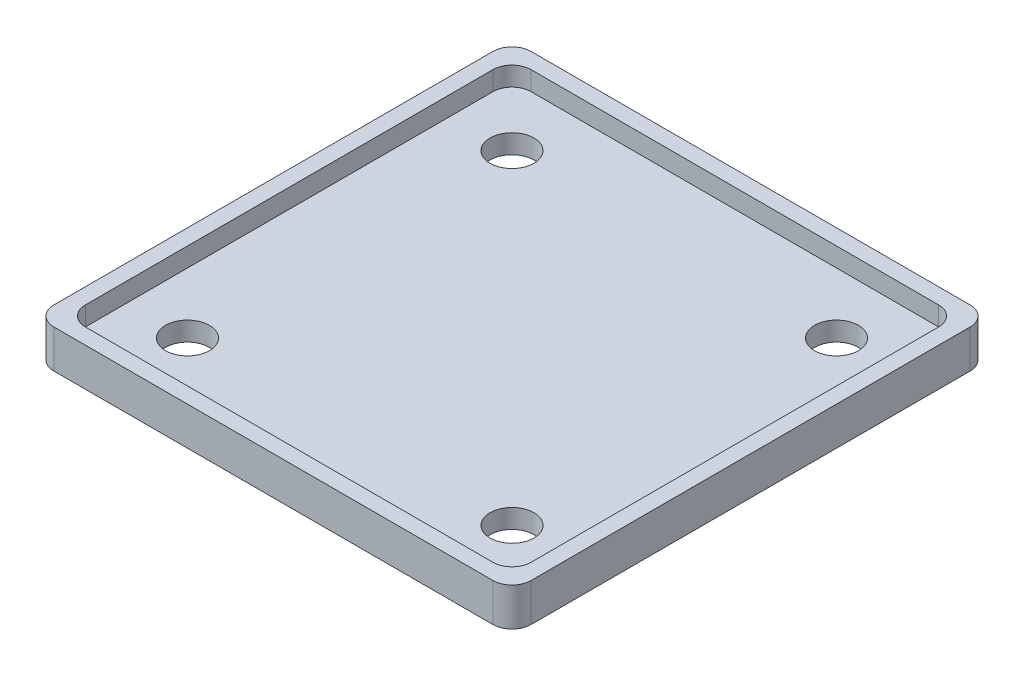
from build123d import *

# Parameters (mm, degrees)
SKETCH1_W           = 25
SKETCH1_H           = 25
BOSS_EXTRUDE1_DEPTH = 2
SKETCH2_R           = 1.15
CUT_EXTRUDE1_DEPTH  = 2
CUT_EXTRUDE2_DEPTH  = 1
FILLET1_R           = 1


with BuildPart() as part:
    # Sketch1 → Boss-Extrude1 (new body)
    with BuildSketch(Plane(origin=(0, 0, 0), x_dir=(1, 0, 0), z_dir=(0, 1, 0))):
        Rectangle(SKETCH1_W, SKETCH1_H)
    extrude(amount=BOSS_EXTRUDE1_DEPTH)

    # Sketch2 → Cut-Extrude1 (cut)
    with BuildSketch(Plane(origin=(0, 2, 0), x_dir=(1, 0, 0), z_dir=(0, 1, 0))):
        with Locations(Location((-8.5, 8.5, 0), (0, 0, 270))):
            Circle(SKETCH2_R)
        with Locations(Location((-8.5, -8.5, 0), (0, 0, 90))):
            Circle(SKETCH2_R)
        with Locations(Location((8.5, -8.5, 0), (0, 0, 270))):
            Circle(SKETCH2_R)
        with Locations(Location((8.5, 8.5, 0), (0, 0, 90))):
            Circle(SKETCH2_R)
    extrude(amount=-CUT_EXTRUDE1_DEPTH, mode=Mode.SUBTRACT)

    # Sketch3 → Cut-Extrude2 (cut)
    with BuildSketch(Plane(origin=(0, 2, 0), x_dir=(1, 0, 0), z_dir=(0, 1, 0))):
        with BuildLine():
            Line((10.675, -11.675), (-10.675, -11.675))
            ThreePointArc((-10.675, -11.675), (-11.382106781, -11.382106781), (-11.675, -10.675))
            Line((-11.675, -10.675), (-11.675, 10.675))
            ThreePointArc((-11.675, 10.675), (-11.382106781, 11.382106781), (-10.675, 11.675))
            Line((-10.675, 11.675), (10.675, 11.675))
            ThreePointArc((10.675, 11.675), (11.382106781, 11.382106781), (11.675, 10.675))
            Line((11.675, 10.675), (11.675, -10.675))
            ThreePointArc((11.675, -10.675), (11.382106781, -11.382106781), (10.675, -11.675))
        make_face()
    extrude(amount=-CUT_EXTRUDE2_DEPTH, mode=Mode.SUBTRACT)

    # Fillet1
    fillet1_edges = [part.edges().sort_by_distance(p)[0] for p in [
        (12.5, 1, 12.5),
        (-12.5, 1, 12.5),
        (-12.5, 1, -12.5),
        (12.5, 1, -12.5),
    ]]
    fillet(fillet1_edges, radius=FILLET1_R)


solid = part.part
